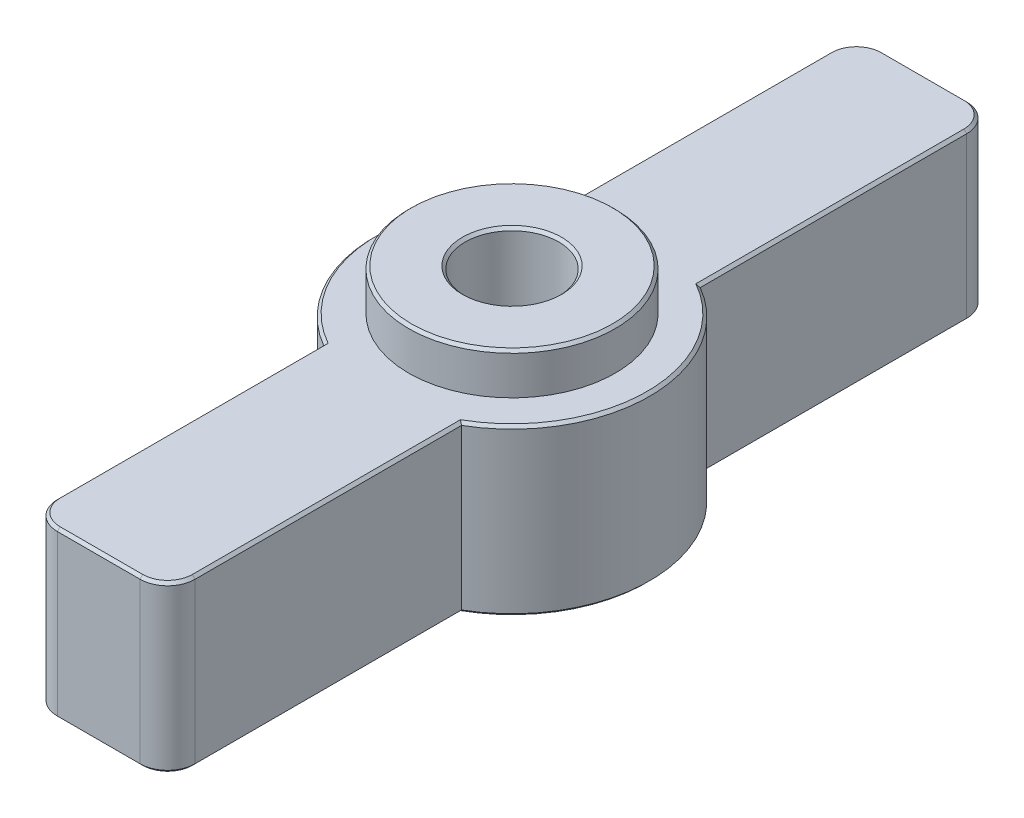
from build123d import *

# Parameters (mm, degrees)
EXTRUDE_1_DEPTH     = 12
SKETCH_2_R          = 6.75
CUT_EXTRUDE_1_DEPTH = 8.5
SKETCH_4_R          = 7.5
EXTRUDE_2_DEPTH     = 3
SKETCH_3_R          = 3.4
CUT_EXTRUDE_2_DEPTH = 33.74522866
CHAMFER_1_SIZE      = 0.2


with BuildPart() as part:
    # 草图1 → 凸台-拉伸1 (new body)
    with BuildSketch(Plane(origin=(0, 0, 0), x_dir=(1, 0, 0), z_dir=(0, 1, 0))):
        with BuildLine():
            Line((-5, -28), (-5, -8.660254038))
            ThreePointArc((-5, -8.660254038), (-10, 0), (-5, 8.660254038))
            Line((-5, 8.660254038), (-5, 28))
            ThreePointArc((-5, 28), (-4.414213562, 29.414213562), (-3, 30))
            Line((-3, 30), (3, 30))
            ThreePointArc((3, 30), (4.414213562, 29.414213562), (5, 28))
            Line((5, 28), (5, 8.660254038))
            ThreePointArc((5, 8.660254038), (10, 0), (5, -8.660254038))
            Line((5, -8.660254038), (5, -28))
            ThreePointArc((5, -28), (4.414213562, -29.414213562), (3, -30))
            Line((3, -30), (-3, -30))
            ThreePointArc((-3, -30), (-4.414213562, -29.414213562), (-5, -28))
        make_face()
    extrude(amount=EXTRUDE_1_DEPTH)

    # 草图2 → 切除-拉伸1 (cut)
    with BuildSketch(Plane.XZ):
        with Locations(Location((0, 0, 0), (0, 0, 270))):
            Circle(SKETCH_2_R)
    extrude(amount=-CUT_EXTRUDE_1_DEPTH, mode=Mode.SUBTRACT)

    # 草图4 → 凸台-拉伸2 (add)
    with BuildSketch(Plane(origin=(0, 12, 0), x_dir=(1, 0, 0), z_dir=(0, 1, 0))):
        with Locations(Location((0, 0, 0), (0, 0, 270))):
            Circle(SKETCH_4_R)
    extrude(amount=EXTRUDE_2_DEPTH)

    # 草图3 → 切除-拉伸2 (cut, through all)
    with BuildSketch(Plane.XZ.offset(-8.5)):
        with Locations(Location((0, 0, 0), (0, 0, 270))):
            Circle(SKETCH_3_R)
    extrude(amount=-CUT_EXTRUDE_2_DEPTH, mode=Mode.SUBTRACT)

    # 倒角1
    chamfer_1_edges = [part.edges().sort_by_distance(p)[0] for p in [
        (5, 0, 18.330127019),
        (4.414213562, 0, 29.414213562),
        (4.414213562, 12, -29.414213562),
        (0, 0, 30),
        (-4.414213562, 0, 29.414213562),
        (-5, 0, 18.330127019),
        (-10, 0, 0),
        (-5, 0, -18.330127019),
        (-4.414213562, 0, -29.414213562),
        (0, 0, -30),
        (4.414213562, 0, -29.414213562),
        (5, 0, -18.330127019),
        (10, 0, 0),
        (0, 12, -30),
        (-4.414213562, 12, -29.414213562),
        (-5, 12, -18.330127019),
        (-10, 12, 0),
        (-5, 12, 18.330127019),
        (-4.414213562, 12, 29.414213562),
        (0, 0, 6.75),
        (0, 12, 30),
        (0, 15, -7.5),
        (4.414213562, 12, 29.414213562),
        (0, 15, 3.4),
        (5, 12, 18.330127019),
        (10, 12, 0),
        (5, 12, -18.330127019),
    ]]
    chamfer(chamfer_1_edges, length=CHAMFER_1_SIZE)


solid = part.part
